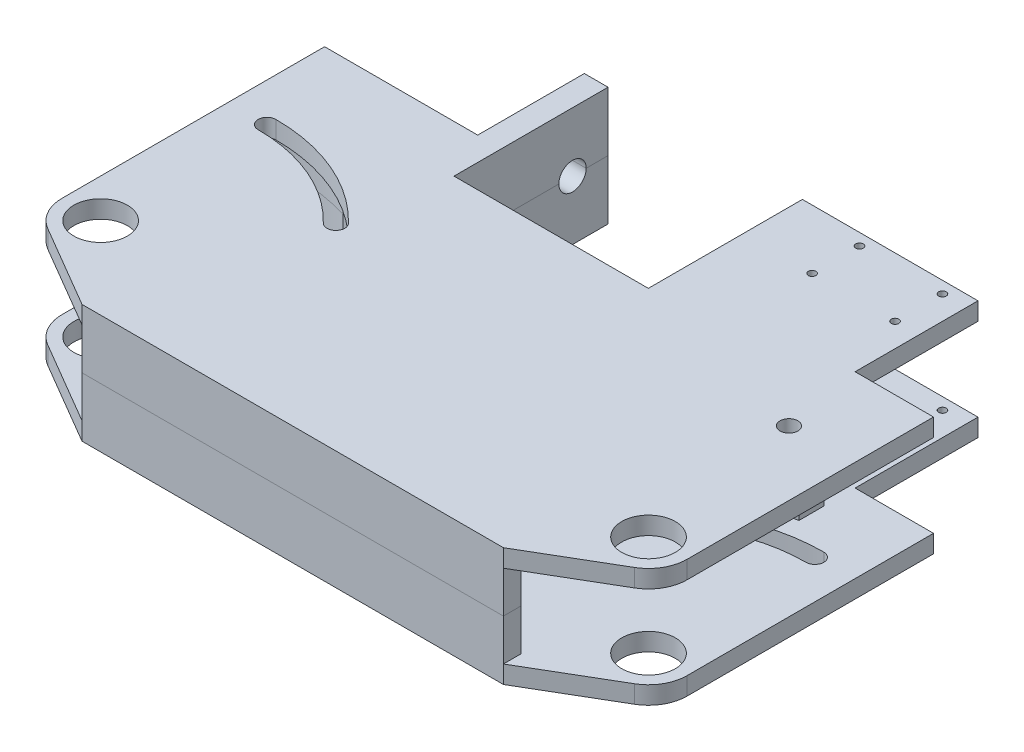
from build123d import *

# Parameters (mm, degrees)
SKETCH1_R           = 14.351
SKETCH1_R_2         = 4.7625
SKETCH1_R_3         = 2.0193
BOSS_EXTRUDE1_DEPTH = 4.7625
SKETCH6_W           = 225.801671476
SKETCH6_H           = 9.525
BOSS_EXTRUDE3_DEPTH = 22.225
CUT_EXTRUDE1_DEPTH  = 167.5
CUT_EXTRUDE3_DEPTH  = 296.798040186
CUT_EXTRUDE8_DEPTH  = 296.798040186
BOSS_EXTRUDE4_START = -9.525
BOSS_EXTRUDE4_DEPTH = 9.525
BOSS_EXTRUDE5_START = -9.525
BOSS_EXTRUDE5_DEPTH = 9.525


with BuildPart() as part:
    # Sketch1 → Boss-Extrude1 (new, symmetric)
    with BuildSketch(Plane(origin=(0, 0, 0), x_dir=(1, 0, 0), z_dir=(0, 1, 0))):
        with BuildLine():
            Line((-112.900835738, 0), (112.900835738, 0))
            Line((112.900835738, 0), (157.266244694, 26.001785981))
            ThreePointArc((157.266244694, 26.001785981), (164.760261557, 33.569504415), (167.5, 43.861466536))
            Line((167.5, 43.861466536), (167.5, 175.877966536))
            Line((167.5, 175.877966536), (125.48138, 175.877966536))
            Line((125.48138, 175.877966536), (125.48138, 241.727466536))
            Line((125.48138, 241.727466536), (31.382, 241.727466536))
            Line((31.382, 241.727466536), (31.382, 159.177466536))
            Line((31.382, 159.177466536), (-72.758, 159.177466536))
            Line((-72.758, 159.177466536), (-72.758, 241.727466536))
            Line((-72.758, 241.727466536), (-85.458, 241.727466536))
            Line((-85.458, 241.727466536), (-85.458, 184.577466536))
            Line((-85.458, 184.577466536), (-167.5, 184.577466536))
            Line((-167.5, 184.577466536), (-167.5, 43.861466536))
            ThreePointArc((-167.5, 43.861466536), (-164.760261557, 33.569504415), (-157.266244694, 26.001785981))
            Line((-157.266244694, 26.001785981), (-112.900835738, 0))
        make_face()
        with Locations(Location((146.799, 43.861466536, 0), (0, 0, 90))):
            Circle(SKETCH1_R, mode=Mode.SUBTRACT)
        with Locations(Location((-132.88802, 133.015466536, 0), (0, 0, 90))):
            Circle(SKETCH1_R_2, mode=Mode.SUBTRACT)
        with Locations(Location((-146.799, 43.861466536, 0), (0, 0, 90))):
            Circle(SKETCH1_R, mode=Mode.SUBTRACT)
        with Locations(Location((132.88802, 133.015466536, 0), (0, 0, 90))):
            Circle(SKETCH1_R_2, mode=Mode.SUBTRACT)
        with Locations(Location((112.78138, 235.377466536, 0), (0, 0, 90))):
            Circle(SKETCH1_R_3, mode=Mode.SUBTRACT)
        with Locations(Location((112.78138, 209.977466536, 0), (0, 0, 90))):
            Circle(SKETCH1_R_3, mode=Mode.SUBTRACT)
        with Locations(Location((68.33138, 209.977466536, 0), (0, 0, 90))):
            Circle(SKETCH1_R_3, mode=Mode.SUBTRACT)
        with Locations(Location((68.33138, 235.377466536, 0), (0, 0, 90))):
            Circle(SKETCH1_R_3, mode=Mode.SUBTRACT)
    extrude(amount=BOSS_EXTRUDE1_DEPTH, both=True)

    # Sketch6 → Boss-Extrude3 (add)
    with BuildSketch(Plane(origin=(0, 4.7625, 0), x_dir=(1, 0, 0), z_dir=(0, 1, 0))):
        with Locations((0, 4.7625)):
            Rectangle(SKETCH6_W, SKETCH6_H)
        with BuildLine():
            Line((-72.758, 159.177466536), (125.48138, 159.177466536))
            Line((125.48138, 159.177466536), (125.48138, 145.796243121))
            ThreePointArc((125.48138, 145.796243121), (121.011342976, 144.758128251), (116.59138, 143.524093904))
            Line((116.59138, 143.524093904), (-116.59138, 143.524093904))
            ThreePointArc((-116.59138, 143.524093904), (-141.896659058, 147.886014856), (-167.5, 145.92325272))
            Line((-167.5, 145.92325272), (-167.5, 184.577466536))
            Line((-167.5, 184.577466536), (-85.458, 184.577466536))
            Line((-85.458, 184.577466536), (-85.458, 241.727466536))
            Line((-85.458, 241.727466536), (-72.758, 241.727466536))
            Line((-72.758, 241.727466536), (-72.758, 159.177466536))
        make_face()
    extrude(amount=BOSS_EXTRUDE3_DEPTH)

    # Sketch5 → Cut-Extrude1 (cut)
    with BuildSketch(Plane(origin=(0, 0, 0), x_dir=(0, 0, -1), z_dir=(1, 0, 0))):
        with BuildLine():
            Line((215.345118117, 26.9875), (230.009814955, 26.9875))
            ThreePointArc((230.009814955, 26.9875), (222.677466536, 19.655151581), (215.345118117, 26.9875))
        make_face()
    extrude(amount=-CUT_EXTRUDE1_DEPTH, mode=Mode.SUBTRACT)


with BuildPart() as body_2:
    # Mirror3: mirrored copy
    add(part.part.mirror(Plane(origin=(-146.799, 26.9875, -43.861466536), x_dir=(0, 0, 1), z_dir=(0, 1, 0))))

    # Sketch7<5> → Cut-Extrude8 (cut, through all)
    with BuildSketch(Plane(origin=(0, 26.9875, 0), x_dir=(1, 0, 0), z_dir=(0, 1, 0))):
        with BuildLine():
            ThreePointArc((-79.1413454, 108.997867621), (-110.036749255, 130.283951413), (-146.799, 137.777966536))
            ThreePointArc((-146.799, 137.777966536), (-151.5615, 133.015466536), (-146.799, 128.252966536))
            ThreePointArc((-146.799, 128.252966536), (-113.765172251, 121.518993515), (-86.003176496, 102.39174175))
            ThreePointArc((-86.003176496, 102.39174175), (-79.269198013, 102.263889138), (-79.1413454, 108.997867621))
        make_face()
    extrude(amount=CUT_EXTRUDE8_DEPTH, mode=Mode.SUBTRACT)

    # Sketch9 → Boss-Extrude5 (add)
    with BuildSketch(Plane(origin=(0, 58.7375, 0), x_dir=(1, 0, 0), z_dir=(0, 1, 0)).offset(BOSS_EXTRUDE5_START)):
        with BuildLine():
            ThreePointArc((-135.37018458, 137.079979452), (-132.320106249, 136.655165719), (-129.285595376, 136.130581795))
            ThreePointArc((-129.285595376, 136.130581795), (-132.153796179, 137.721029375), (-135.37018458, 137.079979452))
        make_face()
    extrude(amount=BOSS_EXTRUDE5_DEPTH)


with BuildPart() as part_1:
    add(part.part)

    # Sketch7 → Cut-Extrude3 (cut, through all)
    with BuildSketch(Plane(origin=(0, 26.9875, 0), x_dir=(1, 0, 0), z_dir=(0, 1, 0))):
        with BuildLine():
            ThreePointArc((79.1413454, 108.997867621), (110.036749255, 130.283951413), (146.799, 137.777966536))
            ThreePointArc((146.799, 137.777966536), (151.5615, 133.015466536), (146.799, 128.252966536))
            ThreePointArc((146.799, 128.252966536), (113.765172251, 121.518993515), (86.003176496, 102.39174175))
            ThreePointArc((86.003176496, 102.39174175), (79.269198013, 102.263889138), (79.1413454, 108.997867621))
        make_face()
    extrude(amount=-CUT_EXTRUDE3_DEPTH, mode=Mode.SUBTRACT)

    # Sketch8 → Boss-Extrude4 (add)
    with BuildSketch(Plane.XZ.offset(4.7625).offset(BOSS_EXTRUDE4_START)):
        with BuildLine():
            ThreePointArc((129.285595376, -136.130581795), (132.320106249, -136.655165719), (135.37018458, -137.079979452))
            ThreePointArc((135.37018458, -137.079979452), (132.153796179, -137.721029375), (129.285595376, -136.130581795))
        make_face()
    extrude(amount=BOSS_EXTRUDE4_DEPTH)


solid = Compound([body_2.part, part_1.part])
